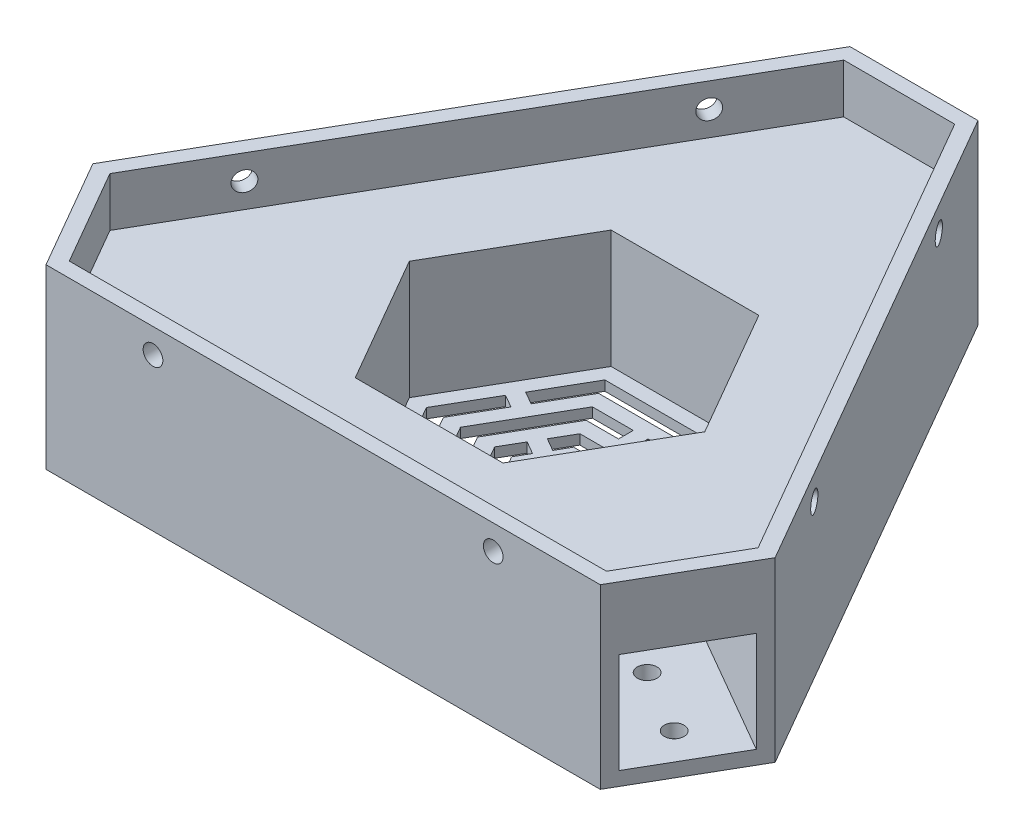
from build123d import *

# Parameters (mm, degrees)
BOSS_EXTRUDE1_DEPTH = 2
BOSS_EXTRUDE2_DEPTH = 26
SKETCH2_W           = 20.4
SKETCH2_H           = 20.4
CUT_EXTRUDE1_DEPTH  = 30
CIRPATTERN1_COUNT   = 3
CUT_EXTRUDE2_DEPTH  = 104.592686872
SKETCH4_R           = 2
CUT_EXTRUDE3_DEPTH  = 10
BOSS_EXTRUDE4_START = 26
BOSS_EXTRUDE4_DEPTH = 10
SKETCH5_R           = 2
CUT_EXTRUDE4_DEPTH  = 10
CIRPATTERN2_COUNT   = 3


with BuildPart() as part:
    # Sketch1 → Boss-Extrude1 (new body)
    with BuildSketch(Plane(origin=(0, 0, 0), x_dir=(1, 0, 0), z_dir=(0, 1, 0))):
        Polygon((15, -25.980762114), (30, 0), (15, 25.980762114), (-15, 25.980762114), (-30, 0), (-15, -25.980762114), align=None)
    extrude(amount=BOSS_EXTRUDE1_DEPTH)

    # Sketch1<3> → Boss-Extrude2 (add)
    # profile 1 of 2: a face of its own
    with BuildSketch(Plane(origin=(0, 0, 0), x_dir=(1, 0, 0), z_dir=(0, 1, 0))):
        Polygon((-13, 72.494446501), (-41.141016151, 23.75277675), (-69.282032303, -24.988893001), (-56.282032303, -47.505553499), (0, -47.505553499), (56.282032303, -47.505553499), (69.282032303, -24.988893001), (41.141016151, 23.75277675), (13, 72.494446501), align=None)
        Polygon((-54.549981495, -44.505553499), (-65.817930688, -24.988893001), (-38.54293994, 22.25277675), (-11.267949192, 69.494446501), (11.267949192, 69.494446501), (38.54293994, 22.25277675), (65.817930688, -24.988893001), (54.549981495, -44.505553499), (0, -44.505553499), align=None, mode=Mode.SUBTRACT)
    # profile 2 of 2: a face of its own
    with BuildSketch(Plane(origin=(0, 0, 0), x_dir=(1, 0, 0), z_dir=(0, 1, 0))):
        Polygon((-65.817930688, -24.988893001), (-38.54293994, 22.25277675), (-11.267949192, 69.494446501), (11.267949192, 69.494446501), (38.54293994, 22.25277675), (65.817930688, -24.988893001), (54.549981495, -44.505553499), (0, -44.505553499), (-54.549981495, -44.505553499), align=None)
        Polygon((30, 0), (15, 25.980762114), (-15, 25.980762114), (-30, 0), (-15, -25.980762114), (15, -25.980762114), align=None, mode=Mode.SUBTRACT)
    extrude(amount=BOSS_EXTRUDE2_DEPTH)

    # Sketch2 → Cut-Extrude1 (cut)
    with BuildSketch(Plane(origin=(62.782032303, 0, 36.24722325), x_dir=(0.499999999999999, 0, -0.8660254037844394), z_dir=(0.8660254037844394, 0, 0.499999999999999))):
        with Locations((0, 13)):
            Rectangle(SKETCH2_W, SKETCH2_H)
    cut_extrude1 = extrude(amount=-CUT_EXTRUDE1_DEPTH, mode=Mode.SUBTRACT)

    # CirPattern1: Cut-Extrude1 ×3 about axis
    cirpattern1_axis = Axis((0, 0, 0), (0, 1, 0))
    for i in range(1, CIRPATTERN1_COUNT):
        add(cut_extrude1.rotate(cirpattern1_axis, i * 360 / CIRPATTERN1_COUNT), mode=Mode.SUBTRACT)

    # Sketch3 → Cut-Extrude2 (cut, through all)
    with BuildSketch(Plane(origin=(0, 26, 0), x_dir=(1, 0, 0), z_dir=(0, 1, 0))):
        Polygon((-5.063466521, -1.191342951), (-5.751288694, 0), (-2.875644347, 4.980762114), (-1.5, 4.980762114), (1.5, 4.980762114), (2.875644347, 4.980762114), (5.751288694, 0), (5.063466521, -1.191342951), (3.563466521, -3.789419162), (2.875644347, -4.980762114), (-2.875644347, -4.980762114), (-3.563466521, -3.789419162), align=None)
        Polygon((6.161542732, -5.289419162), (6.911542732, -3.990381057), (7.661542732, -2.691342951), (9.215390309, 0), (7.661542732, 2.691342951), (10.259618943, 4.191342951), (12.679491924, 0), (9.509618943, -5.490381057), (6.339745962, -10.980762114), (1.5, -10.980762114), (1.5, -7.980762114), (4.607695155, -7.980762114), align=None)
        Polygon((-6.339745962, 10.980762114), (0, 10.980762114), (6.339745962, 10.980762114), (8.759618943, 6.789419162), (6.161542732, 5.289419162), (4.607695155, 7.980762114), (1.5, 7.980762114), (0, 7.980762114), (-1.5, 7.980762114), (-4.607695155, 7.980762114), (-6.161542732, 5.289419162), (-8.759618943, 6.789419162), align=None)
        Polygon((-7.661542732, -2.691342951), (-6.911542732, -3.990381057), (-6.161542732, -5.289419162), (-4.607695155, -7.980762114), (-1.5, -7.980762114), (-1.5, -10.980762114), (-6.339745962, -10.980762114), (-9.509618943, -5.490381057), (-12.679491924, 0), (-10.259618943, 4.191342951), (-7.661542732, 2.691342951), (-9.215390309, 0), align=None)
        Polygon((-9.803847577, -16.980762114), (-13.955771366, -9.789419162), (-11.357695155, -8.289419162), (-8.07179677, -13.980762114), (8.07179677, -13.980762114), (11.357695155, -8.289419162), (13.955771366, -9.789419162), (9.803847577, -16.980762114), align=None)
        Polygon((19.607695155, 0), (15.455771366, -7.191342951), (12.857695155, -5.691342951), (16.143593539, 0), (8.07179677, 13.980762114), (1.5, 13.980762114), (1.5, 16.980762114), (9.803847577, 16.980762114), align=None)
        Polygon((-9.803847577, 16.980762114), (-1.5, 16.980762114), (-1.5, 13.980762114), (-8.07179677, 13.980762114), (-16.143593539, 0), (-12.857695155, -5.691342951), (-15.455771366, -7.191342951), (-19.607695155, 0), align=None)
        Polygon((0, 22.980762114), (13.267949192, 22.980762114), (19.151923789, 12.789419162), (16.553847577, 11.289419162), (11.535898385, 19.980762114), (0, 19.980762114), (-11.535898385, 19.980762114), (-16.553847577, 11.289419162), (-19.151923789, 12.789419162), (-13.267949192, 22.980762114), align=None)
        Polygon((-23.07179677, 0), (-17.303847577, -9.990381057), (-11.535898385, -19.980762114), (-1.5, -19.980762114), (-1.5, -22.980762114), (-13.267949192, -22.980762114), (-19.901923789, -11.490381057), (-26.535898385, 0), (-20.651923789, 10.191342951), (-18.053847577, 8.691342951), align=None)
        Polygon((11.535898385, -19.980762114), (17.303847577, -9.990381057), (23.07179677, 0), (18.053847577, 8.691342951), (20.651923789, 10.191342951), (26.535898385, 0), (19.901923789, -11.490381057), (13.267949192, -22.980762114), (1.5, -22.980762114), (1.5, -19.980762114), align=None)
    extrude(amount=-CUT_EXTRUDE2_DEPTH, mode=Mode.SUBTRACT)

    # Sketch4 → Cut-Extrude3 (cut)
    with BuildSketch(Plane.XZ):
        with Locations(Location((0, -64.994446501, 0), (0, 0, 270))):
            Circle(SKETCH4_R)
        with Locations(Location((0, -49.994446501, 0), (0, 0, 270))):
            Circle(SKETCH4_R)
        with Locations(Location((-56.286841774, 32.49722325, 0), (0, 0, 270))):
            Circle(SKETCH4_R)
        with Locations(Location((-43.296460718, 24.99722325, 0), (0, 0, 270))):
            Circle(SKETCH4_R)
        with Locations(Location((56.286841774, 32.49722325, 0), (0, 0, 270))):
            Circle(SKETCH4_R)
        with Locations(Location((43.296460718, 24.99722325, 0), (0, 0, 270))):
            Circle(SKETCH4_R)
    extrude(amount=-CUT_EXTRUDE3_DEPTH, mode=Mode.SUBTRACT)

    # Sketch1<5> → Boss-Extrude4 (add)
    with BuildSketch(Plane(origin=(0, 0, 0), x_dir=(1, 0, 0), z_dir=(0, 1, 0)).offset(BOSS_EXTRUDE4_START)):
        Polygon((-13, 72.494446501), (-41.141016151, 23.75277675), (-69.282032303, -24.988893001), (-56.282032303, -47.505553499), (0, -47.505553499), (56.282032303, -47.505553499), (69.282032303, -24.988893001), (41.141016151, 23.75277675), (13, 72.494446501), align=None)
        Polygon((-54.549981495, -44.505553499), (-65.817930688, -24.988893001), (-38.54293994, 22.25277675), (-11.267949192, 69.494446501), (11.267949192, 69.494446501), (38.54293994, 22.25277675), (65.817930688, -24.988893001), (54.549981495, -44.505553499), (0, -44.505553499), align=None, mode=Mode.SUBTRACT)
    extrude(amount=BOSS_EXTRUDE4_DEPTH)

    # Sketch5 → Cut-Extrude4 (cut)
    with BuildSketch(Plane(origin=(-38.54293994, 0, -22.25277675), x_dir=(0.4999999999999866, 0, -0.8660254037844465), z_dir=(0.8660254037844464, 0, 0.49999999999998657))):
        with Locations((-34.549981495, 31)):
            Circle(SKETCH5_R)
        with Locations((34.549981495, 31)):
            Circle(SKETCH5_R)
    cut_extrude4 = extrude(amount=-CUT_EXTRUDE4_DEPTH, mode=Mode.SUBTRACT)

    # CirPattern2: Cut-Extrude4 ×3 about axis
    cirpattern2_axis = Axis((0, 27.3, 0), (0, -1, 0))
    for i in range(1, CIRPATTERN2_COUNT):
        add(cut_extrude4.rotate(cirpattern2_axis, i * 360 / CIRPATTERN2_COUNT), mode=Mode.SUBTRACT)


solid = part.part
